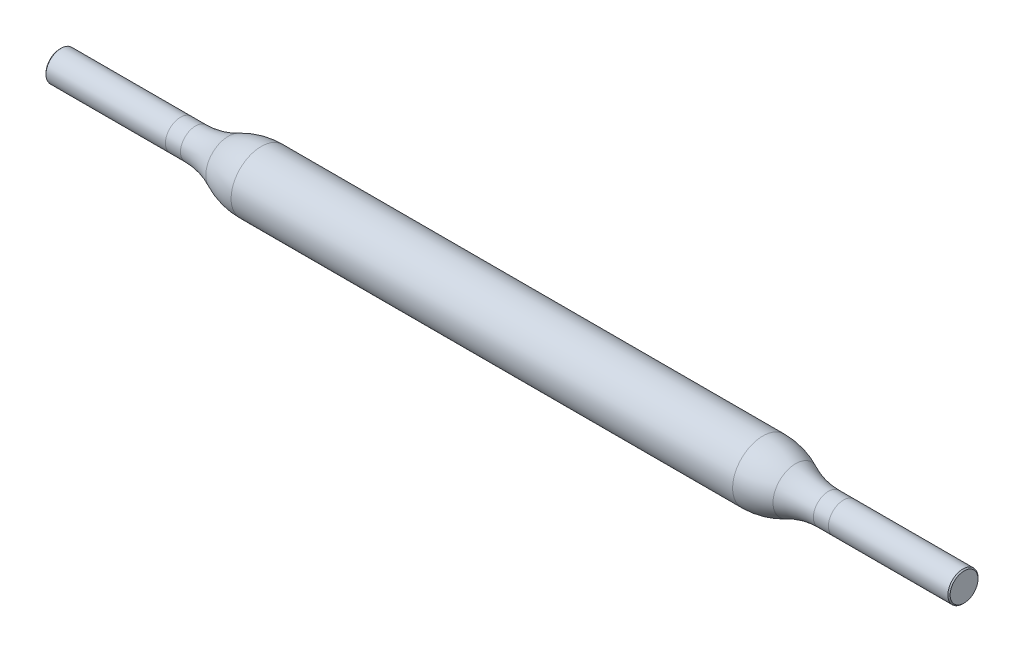
from build123d import *

# Parameters (mm, degrees)
CHAMFER1_SIZE = 0.075


with BuildPart() as part:
    # Sketch1 → Revolve1 (revolve)
    with BuildSketch(Plane.XY, mode=Mode.PRIVATE) as revolve1_sk:
        with BuildLine():
            Line((-30, 0), (30, 0))
            Line((30, 0), (30, 1))
            Line((30, 1), (21, 1))
            ThreePointArc((21, 1), (19.881966011, 1.126602828), (18.820550528, 1.5))
            ThreePointArc((18.820550528, 1.5), (17.759135045, 1.873397172), (16.641101056, 2))
            Line((16.641101056, 2), (-16.641101056, 2))
            ThreePointArc((-16.641101056, 2), (-17.759135045, 1.873397172), (-18.820550528, 1.5))
            ThreePointArc((-18.820550528, 1.5), (-19.881966011, 1.126602828), (-21, 1))
            Line((-21, 1), (-30, 1))
            Line((-30, 1), (-30, 0))
        make_face()
    revolve(revolve1_sk.sketch.rotate(Axis((-30, 0, 0), (1, 0, 0)), 180), axis=Axis((-30, 0, 0), (1, 0, 0)))

    # Chamfer1
    chamfer1_edges = [part.edges().sort_by_distance(p)[0] for p in [
        (30, 1, 0),
        (-30, 1, 0),
    ]]
    chamfer(chamfer1_edges, length=CHAMFER1_SIZE)


solid = part.part
